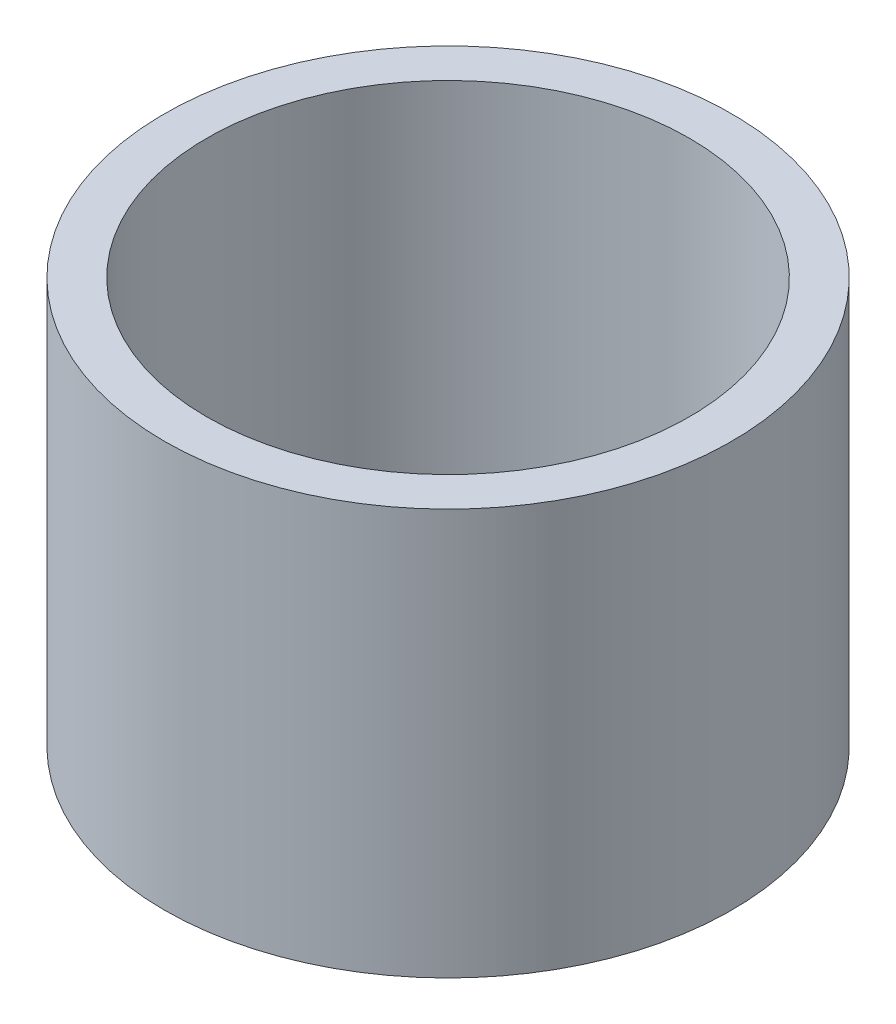
from build123d import *

# Parameters (mm, degrees)
CROQUIS3_R              = 34.93
CROQUIS3_R_2            = 29.72
SALIENTE_EXTRUIR2_DEPTH = 50


with BuildPart() as part:
    # Croquis3 → Saliente-Extruir2 (new body)
    with BuildSketch(Plane(origin=(0, 0, 0), x_dir=(1, 0, 0), z_dir=(0, 1, 0))):
        with Locations(Location((0, 0, 0), (0, 0, 270))):
            Circle(CROQUIS3_R)
        with Locations(Location((0, 0, 0), (0, 0, 270))):
            Circle(CROQUIS3_R_2, mode=Mode.SUBTRACT)
    extrude(amount=SALIENTE_EXTRUIR2_DEPTH)


solid = part.part
